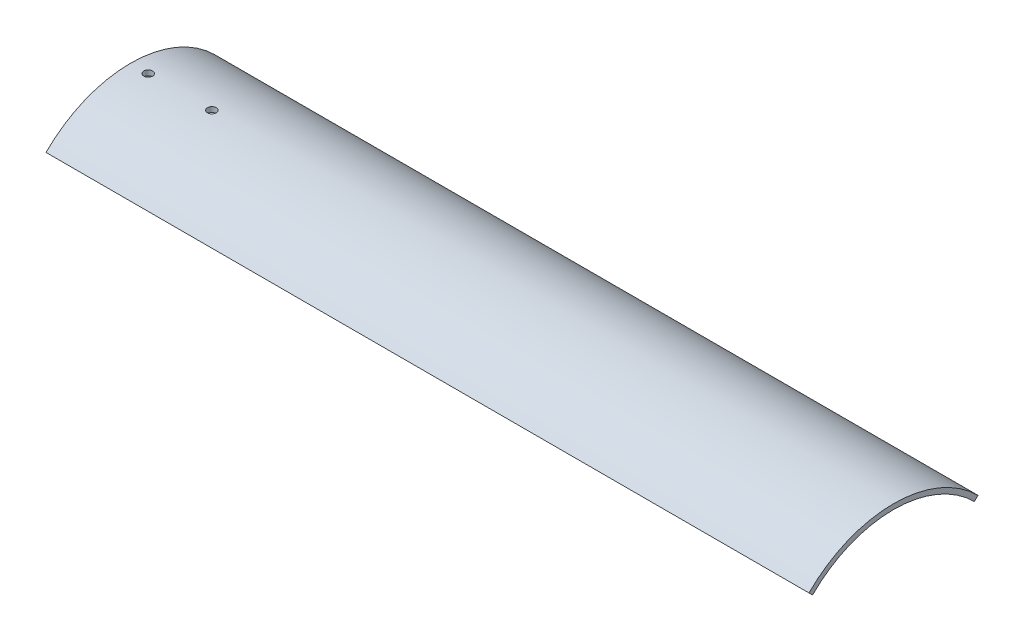
from build123d import *

# Parameters (mm, degrees)
BOSS_EXTRUDE1_DEPTH = 300
SKETCH3_R           = 1.75
CUT_EXTRUDE1_DEPTH  = 306.897117362


with BuildPart() as part:
    # Sketch1 → Boss-Extrude1 (new body)
    with BuildSketch(Plane(origin=(0, 0, 0), x_dir=(0, 0, -1), z_dir=(1, 0, 0))):
        with BuildLine():
            Line((31.819805153, 31.819805153), (33.234018716, 33.234018716))
            ThreePointArc((33.234018716, 33.234018716), (0, 47), (-33.234018716, 33.234018716))
            Line((-33.234018716, 33.234018716), (-31.819805153, 31.819805153))
            ThreePointArc((-31.819805153, 31.819805153), (0, 45), (31.819805153, 31.819805153))
        make_face()
    extrude(amount=BOSS_EXTRUDE1_DEPTH)

    # Sketch3 → Cut-Extrude1 (cut, through all)
    with BuildSketch(Plane(origin=(0, 0, -3.698980221), x_dir=(1, 0, 0), z_dir=(0, 1, 0))):
        with Locations(Location((7, -3.698980221, 0), (0, 0, 90))):
            Circle(SKETCH3_R)
        with Locations(Location((32, -3.698980221, 0), (0, 0, 90))):
            Circle(SKETCH3_R)
    extrude(amount=CUT_EXTRUDE1_DEPTH, mode=Mode.SUBTRACT)


solid = part.part
